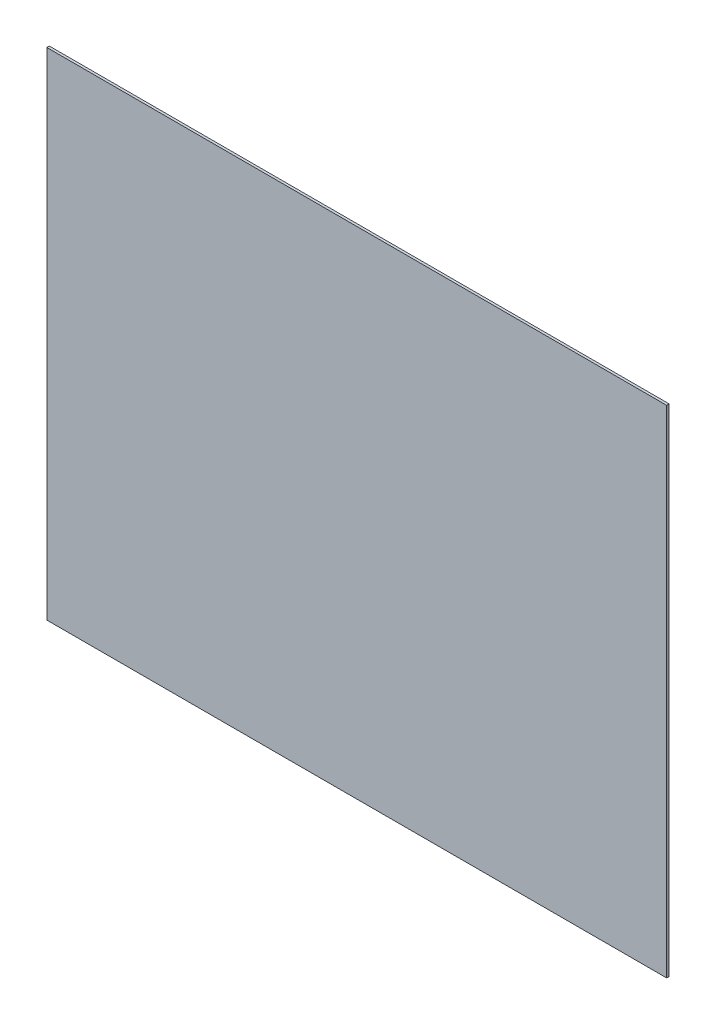
from build123d import *

# Parameters (mm, degrees)
TOPPING_ARKA_DUVAR_PANO_PLAKASI_1_START = -776
SKETCH1_W                               = 500
SKETCH1_H                               = 400
TOPPING_ARKA_DUVAR_PANO_PLAKASI_1_DEPTH = 2


with BuildPart() as part:
    # Sketch1 → TOPPING_arka_duvar_pano_plakasi_1 (new body)
    with BuildSketch(Plane.XY.offset(TOPPING_ARKA_DUVAR_PANO_PLAKASI_1_START)):
        with Locations((350, 500)):
            Rectangle(SKETCH1_W, SKETCH1_H)
    extrude(amount=-TOPPING_ARKA_DUVAR_PANO_PLAKASI_1_DEPTH)


solid = part.part
